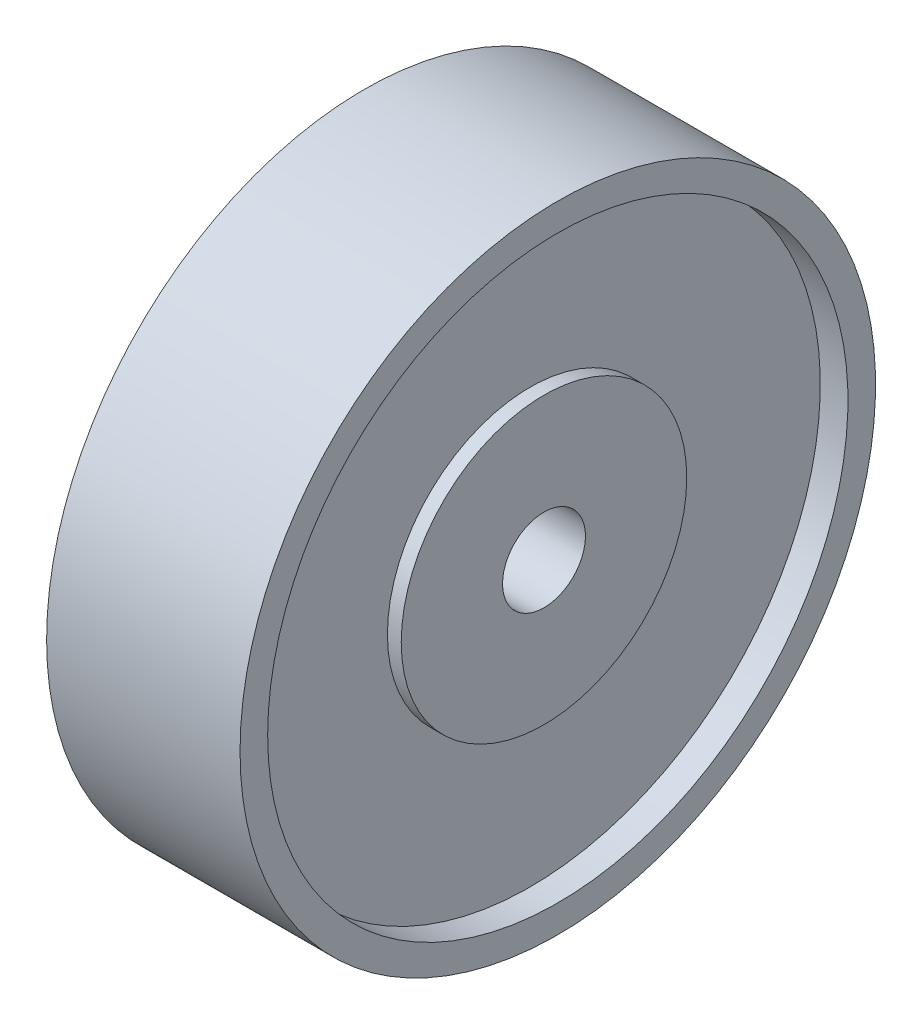
from build123d import *


with BuildPart() as part:
    # Sketch3 → Revolve1 (revolve)
    with BuildSketch(Plane.XY, mode=Mode.PRIVATE) as revolve1_sk:
        Polygon((-25, 15), (0, 15), (0, 115), (-35, 115), (-35, 105), (-25, 105), (-25, 51.665831819), (-30, 51.665831819), (-30, 15), align=None)
        Polygon((0, 115), (0, 15), (25, 15), (30, 15), (30, 51.665831819), (25, 51.665831819), (25, 105), (35, 105), (35, 115), align=None)
    revolve(revolve1_sk.sketch.rotate(Axis((0, 0, 0), (1, 0, 0)), 90), axis=Axis((0, 0, 0), (1, 0, 0)))


solid = part.part
